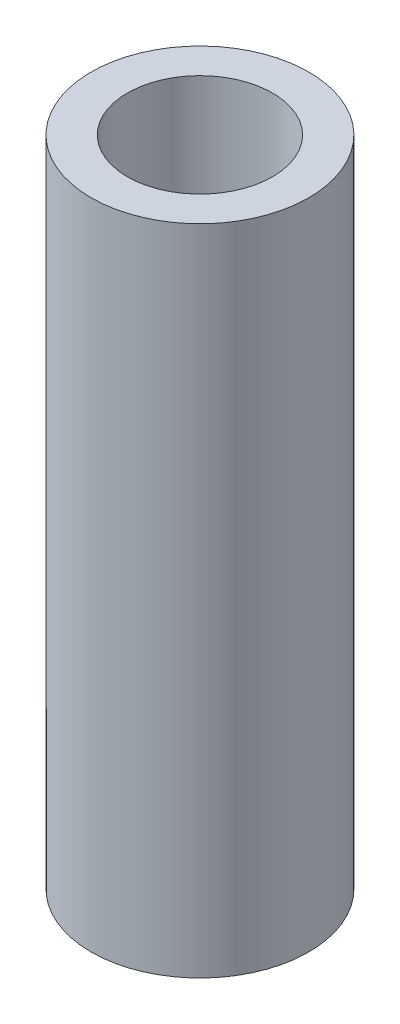
from build123d import *

# Parameters (mm, degrees)
SKETCH1_R           = 3
BOSS_EXTRUDE1_DEPTH = 18
SKETCH2_R           = 2
CUT_EXTRUDE1_DEPTH  = 19.493242009


with BuildPart() as part:
    # Sketch1 → Boss-Extrude1 (new body)
    with BuildSketch(Plane(origin=(0, 0, 0), x_dir=(1, 0, 0), z_dir=(0, 1, 0))):
        with Locations(Location((0, 0, 0), (0, 0, 270))):
            Circle(SKETCH1_R)
    extrude(amount=BOSS_EXTRUDE1_DEPTH)

    # Sketch2 → Cut-Extrude1 (cut, through all)
    with BuildSketch(Plane(origin=(0, 18, 0), x_dir=(1, 0, 0), z_dir=(0, 1, 0))):
        with Locations(Location((0, 0, 0), (0, 0, 270))):
            Circle(SKETCH2_R)
    extrude(amount=-CUT_EXTRUDE1_DEPTH, mode=Mode.SUBTRACT)


solid = part.part
